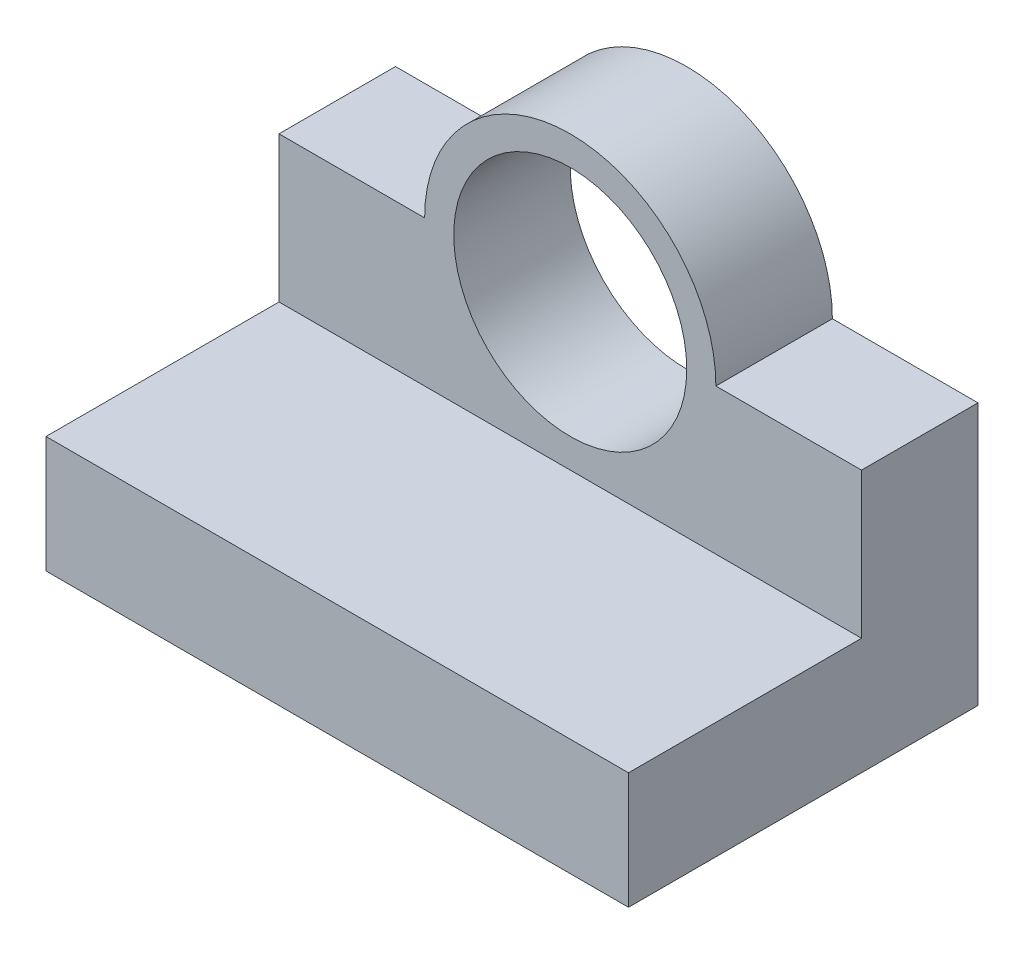
from build123d import *

# Parameters (mm, degrees)
SKETCH2_W           = 100
SKETCH2_H           = 60
BOSS_EXTRUDE1_DEPTH = 20
SKETCH3_W           = 100
SKETCH3_H           = 20
BOSS_EXTRUDE2_DEPTH = 25
SKETCH4_R           = 25
SKETCH4_R_2         = 20
BOSS_EXTRUDE3_DEPTH = 20
SKETCH5_R           = 20
CUT_EXTRUDE2_DEPTH  = 20


with BuildPart() as part:
    # Sketch2 → Boss-Extrude1 (new body)
    with BuildSketch(Plane(origin=(0, 0, 0), x_dir=(1, 0, 0), z_dir=(0, 1, 0))):
        Rectangle(SKETCH2_W, SKETCH2_H)
    extrude(amount=BOSS_EXTRUDE1_DEPTH)

    # Sketch3 → Boss-Extrude2 (add)
    with BuildSketch(Plane(origin=(0, 20, 0), x_dir=(1, 0, 0), z_dir=(0, 1, 0))):
        with Locations((0, 20)):
            Rectangle(SKETCH3_W, SKETCH3_H)
    extrude(amount=BOSS_EXTRUDE2_DEPTH)

    # Sketch4 → Boss-Extrude3 (add)
    with BuildSketch(Plane.XY.offset(-10)):
        with Locations((0, 45)):
            Circle(SKETCH4_R)
        with Locations((0, 45)):
            Circle(SKETCH4_R_2, mode=Mode.SUBTRACT)
    extrude(amount=-BOSS_EXTRUDE3_DEPTH)

    # Sketch5 → Cut-Extrude2 (cut)
    with BuildSketch(Plane.XY.offset(-10)):
        with Locations((0, 45)):
            Circle(SKETCH5_R)
    extrude(amount=-CUT_EXTRUDE2_DEPTH, mode=Mode.SUBTRACT)


solid = part.part
